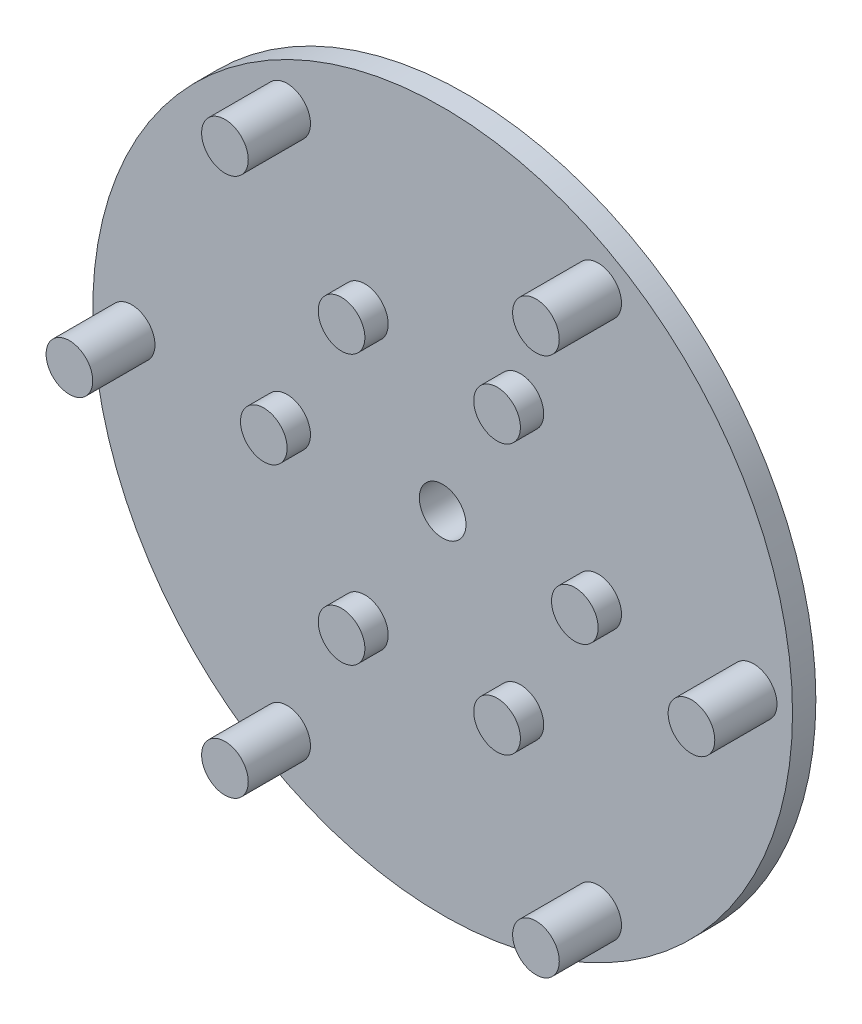
from build123d import *
from build123d.topology import SkipClean

# Parameters (mm, degrees)
SKETCH_1_R          = 45
EXTRUDE_1_DEPTH     = 3
SKETCH_2_R          = 3
EXTRUDE_2_DEPTH     = 8
SKETCH_4_R          = 3
EXTRUDE_4_DEPTH     = 3
CUT_EXTRUDE_1_REACH = 66.14
SKETCH_3_R          = 3
SKETCH_5_R          = 6
SKETCH_5_R_2        = 3
EXTRUDE_1_2_DEPTH   = 6


with BuildPart() as part:
    # 草图1 → Extrude 1 (new body)
    with BuildSketch(Plane.XY):
        Circle(SKETCH_1_R)
    extrude(amount=-EXTRUDE_1_DEPTH)

    # 草图2 → 凸台-拉伸2 (add)
    with BuildSketch(Plane.XY):
        with Locations((-40, 0)):
            Circle(SKETCH_2_R)
        with Locations((-20, 34.641016151)):
            Circle(SKETCH_2_R)
        with Locations((20, 34.641016151)):
            Circle(SKETCH_2_R)
        with Locations((40, 0)):
            Circle(SKETCH_2_R)
        with Locations((20, -34.641016151)):
            Circle(SKETCH_2_R)
        with Locations((-20, -34.641016151)):
            Circle(SKETCH_2_R)
    extrude(amount=EXTRUDE_2_DEPTH)

    # 草图4 → 凸台-拉伸4 (add)
    with BuildSketch(Plane.XY):
        with Locations((-10, 17.320508076)):
            Circle(SKETCH_4_R)
        with Locations((10, 17.320508076)):
            Circle(SKETCH_4_R)
        with Locations((20, 0)):
            Circle(SKETCH_4_R)
        with Locations((10, -17.320508076)):
            Circle(SKETCH_4_R)
        with Locations((-10, -17.320508076)):
            Circle(SKETCH_4_R)
        with Locations((-20, 0)):
            Circle(SKETCH_4_R)
    extrude(amount=EXTRUDE_4_DEPTH)

    # 草图3 → 切除-拉伸1 (cut, up to next)
    with BuildSketch(Plane.XY, mode=Mode.PRIVATE) as cut_extrude_1_sk1:
        Circle(SKETCH_3_R)
    cut_extrude_1_tool1 = extrude(cut_extrude_1_sk1.sketch, amount=-CUT_EXTRUDE_1_REACH, mode=Mode.PRIVATE) & part.part
    add(cut_extrude_1_tool1.solids().sort_by_distance((0, 0, 0))[0], mode=Mode.SUBTRACT)

    # 草图5 → Extrude 1 2 (add)
    with SkipClean():  # the faces are left unmerged after this step: merging them gives an invalid solid
        with BuildSketch(Plane(origin=(0, 0, -3), x_dir=(-1, 0, 0), z_dir=(0, 0, -1))):
            Circle(SKETCH_5_R)
            Circle(SKETCH_5_R_2, mode=Mode.SUBTRACT)
        extrude(amount=EXTRUDE_1_2_DEPTH)


solid = part.part
